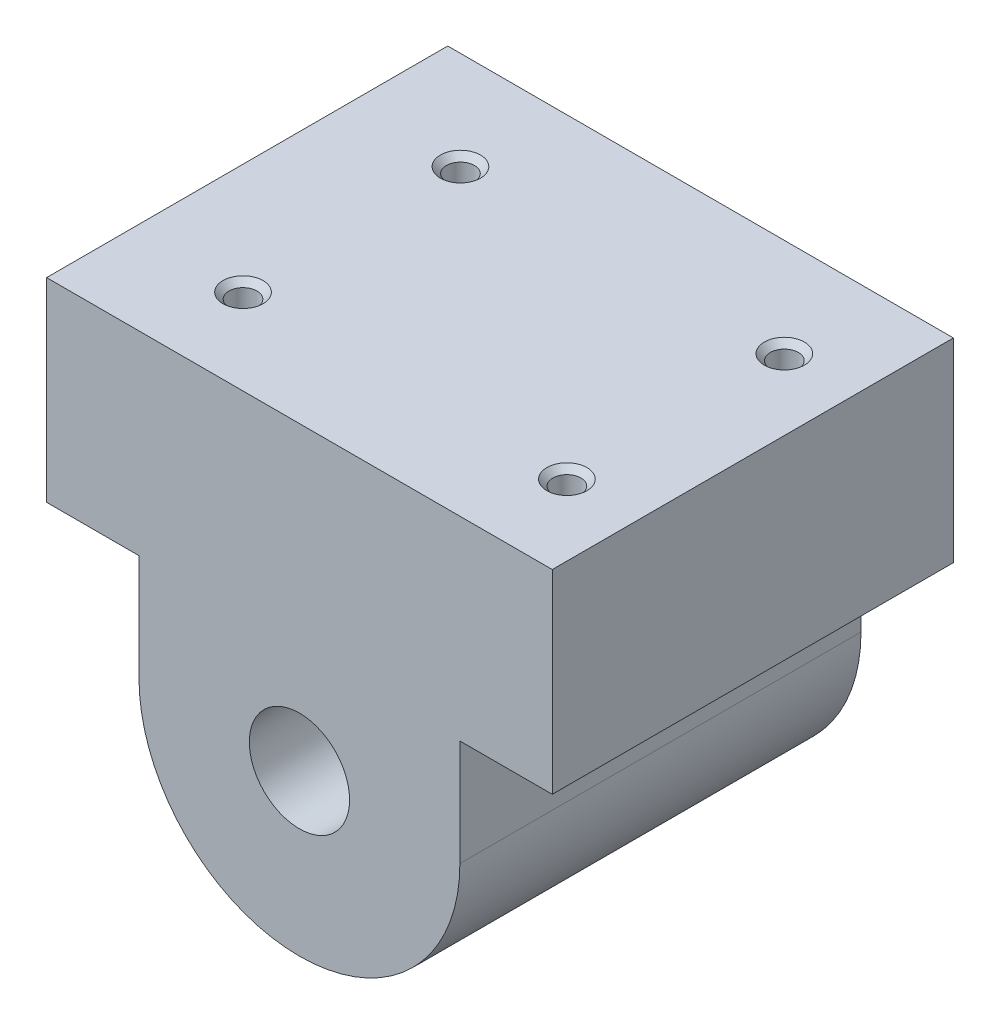
from build123d import *

# Parameters (mm, degrees)
EXTRUDE_1_DEPTH     = 200
SKETCH_2_W          = 200
SKETCH_2_H          = 97.057417657
EXTRUDE_2_DEPTH     = 46.061398085
SKETCH_3_W          = 200
SKETCH_3_H          = 97.057417639
EXTRUDE_3_DEPTH     = 46.061398049
HOLE_WIZARD_1_D     = 50
HOLE_WIZARD_2_D     = 14
HOLE_WIZARD_2_DEPTH = 30
HOLE_WIZARD_2_TIP   = 4.206024333
CHAMFER_1_SIZE      = 3


with BuildPart() as part:
    # 草图1 → 凸台-拉伸1 (new body)
    with BuildSketch(Plane.XY.offset(100)):
        with BuildLine():
            Line((80.000000036, 0), (80.000000036, 150))
            Line((80.000000036, 150), (-80.000000036, 150))
            Line((-80.000000036, 150), (-80.000000036, 0))
            ThreePointArc((-80.000000036, 0), (0, -80.000000036), (80.000000036, 0))
        make_face()
    extrude(amount=-EXTRUDE_1_DEPTH)

    # 草图2 → 凸台-拉伸2 (add)
    with BuildSketch(Plane(origin=(80.000000036, 0, 0), x_dir=(0, 0, -1), z_dir=(1, 0, 0))):
        with Locations((0, 101.471291153)):
            Rectangle(SKETCH_2_W, SKETCH_2_H)
    extrude(amount=EXTRUDE_2_DEPTH)

    # 草图3 → 凸台-拉伸3 (add)
    with BuildSketch(Plane.ZY.offset(80.000000036)):
        with Locations((0, 101.471291181)):
            Rectangle(SKETCH_3_W, SKETCH_3_H)
    extrude(amount=EXTRUDE_3_DEPTH)

    # 孔1 (through all)
    with Locations(Plane.XY.offset(100)):
        with Locations((0, 0)):
            Hole(HOLE_WIZARD_1_D / 2)

    # 孔2
    with Locations(Plane(origin=(0, 150, 0), x_dir=(1, 0, 0), z_dir=(0, 1, 0))):
        with Locations((-70.811035645, 51.091167344), (-70.811035645, -57.320629237), (90.685157882, -57.320629237), (90.685157882, 51.091167344)):
            Hole(HOLE_WIZARD_2_D / 2, depth=HOLE_WIZARD_2_DEPTH)
            with Locations((0, 0, -(HOLE_WIZARD_2_DEPTH + HOLE_WIZARD_2_TIP / 2))):  # 118° drill point
                Cone(0, HOLE_WIZARD_2_D / 2, HOLE_WIZARD_2_TIP, mode=Mode.SUBTRACT)

    # 倒角1
    chamfer_1_edges = [part.edges().sort_by_distance(p)[0] for p in [
        (97.685157882, 150, -51.091167344),
        (97.685157882, 150, 57.320629237),
        (-63.811035645, 150, 57.320629237),
        (-63.811035645, 150, -51.091167344),
    ]]
    chamfer(chamfer_1_edges, length=CHAMFER_1_SIZE)


solid = part.part
